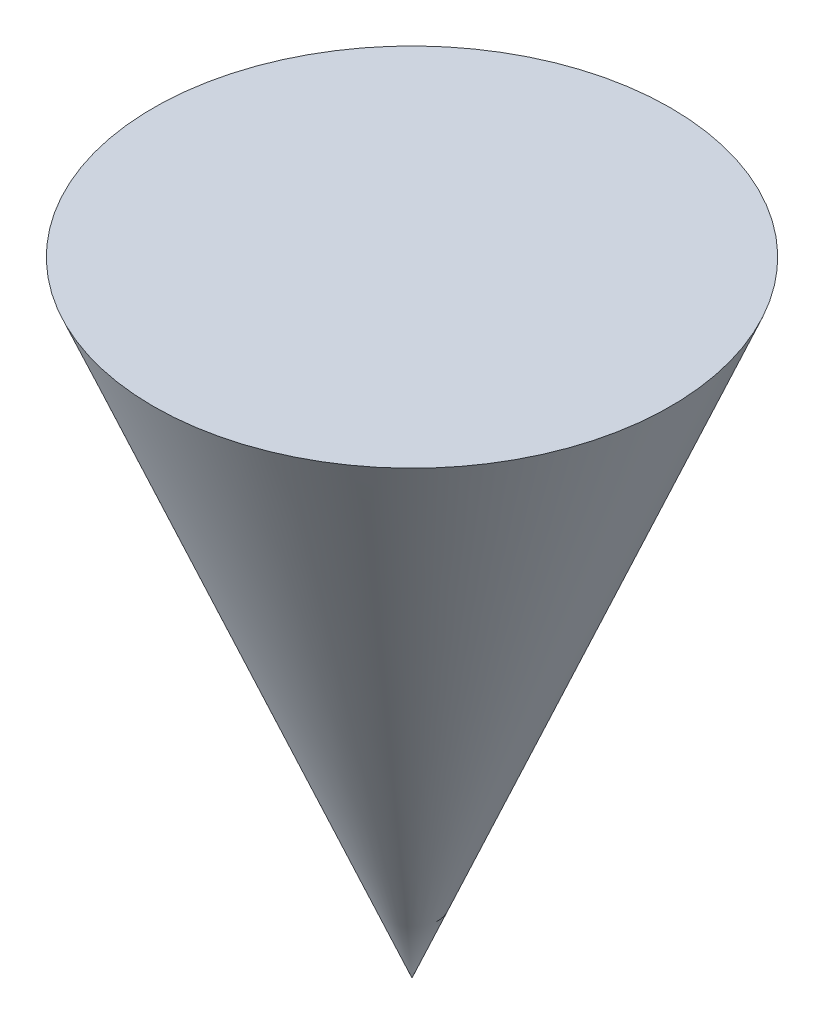
from build123d import *


with BuildPart() as part:
    # Sketch1 → Revolve1 (revolve)
    with BuildSketch(Plane.XY, mode=Mode.PRIVATE) as revolve1_sk:
        Polygon((0, 0), (8.284271247, 20), (0, 20), align=None)
    revolve(revolve1_sk.sketch.rotate(Axis((0, 0, 0), (0, 1, 0)), 270), axis=Axis((0, 0, 0), (0, 1, 0)))


solid = part.part
